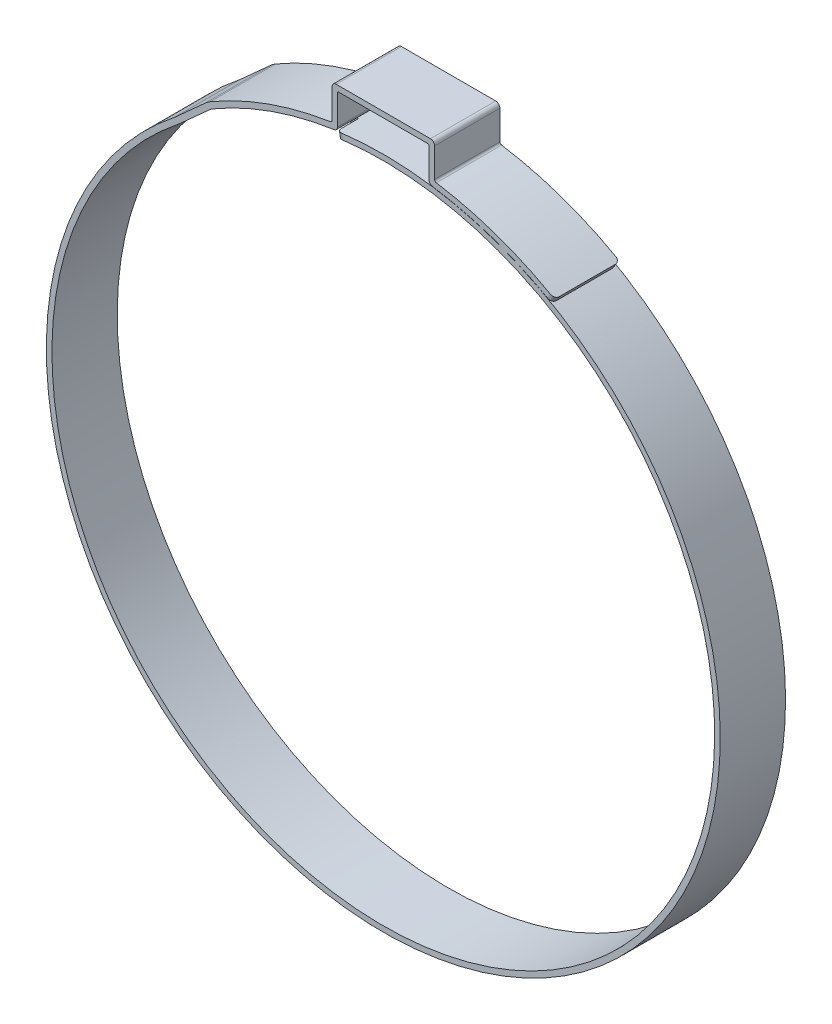
from build123d import *

# Parameters (mm, degrees)
BOSS_EXTRUDE1_DEPTH = 3.571875
SHELL1_T            = -0.6096
EXTRUDE_THIN3_DEPTH = 3.571875
EXTRUDE_THIN4_DEPTH = 3.571875
EXTRUDE_THIN6_DEPTH = 1.190625
FILLET4_R           = 0.4572
FILLET5_R           = 0.2286
FILLET6_R           = 0.1143
FILLET7_R           = 0.508


with BuildPart() as part:
    # Sketch1 → Boss-Extrude1 (new, symmetric)
    with BuildSketch(Plane.XY):
        Polygon((-5.6096, 36.544537554), (-5.6096, 40.904137554), (5.6096, 40.904137554), (5.6096, 36.544537554), (5, 36.544537554), (-5, 36.544537554), align=None)
    extrude(amount=BOSS_EXTRUDE1_DEPTH, both=True)

    # Shell1
    shell1_openings = [part.faces().sort_by_distance(p)[0] for p in [
        (0, 38.724337554, 3.571875),
        (0, 36.544537554, 0),
        (0, 38.724337554, -3.571875),
    ]]
    offset(amount=SHELL1_T, openings=shell1_openings, kind=Kind.INTERSECTION)

    # Sketch5 → Extrude-Thin3 (add, symmetric)
    with BuildSketch(Plane.XY):
        with BuildLine():
            ThreePointArc((5, 36.544537554), (11.940161205, 34.898936594), (18.433839197, 31.94834577))
            Line((18.433839197, 31.94834577), (18.73849606, 32.476357471))
            ThreePointArc((18.73849606, 32.476357471), (12.137496769, 35.475712838), (5.082635218, 37.148510716))
            Line((5.082635218, 37.148510716), (5, 36.544537554))
        make_face()
    extrude(amount=EXTRUDE_THIN3_DEPTH, both=True)

    # Sketch6 → Extrude-Thin4 (add, symmetric)
    with BuildSketch(Plane.XY):
        with BuildLine():
            ThreePointArc((-5, 36.544537554), (-12.040640524, 34.864397324), (-18.617591459, 31.841616059))
            ThreePointArc((-18.617591459, 31.841616059), (-18.834321384, 31.699568311), (-19.035434065, 31.536157441))
            Line((-19.035434065, 31.536157441), (-22.368712445, 28.532557322))
            ThreePointArc((-22.368712445, 28.532557322), (-22.429942096, 28.479134983), (-22.492850889, 28.427700556))
            ThreePointArc((-22.492850889, 28.427700556), (-25.983133611, 25.277248025), (-29.036283269, 21.701538054))
            ThreePointArc((-29.036283269, 21.701538054), (18.440205881, -31.209314428), (-5, 35.903516541))
            Line((-5, 35.903516541), (-5.084082759, 36.507289884))
            ThreePointArc((-5.084082759, 36.507289884), (18.750306557, -31.734147479), (-29.524573428, 22.066483092))
            ThreePointArc((-29.524573428, 22.066483092), (-26.420080322, 25.702324174), (-22.871103079, 28.905756453))
            ThreePointArc((-22.871103079, 28.905756453), (-22.823307272, 28.944834455), (-22.776787215, 28.985422801))
            Line((-22.776787215, 28.985422801), (-19.443508835, 31.989022921))
            ThreePointArc((-19.443508835, 31.989022921), (-19.194081556, 32.191691038), (-18.925285204, 32.367863833))
            ThreePointArc((-18.925285204, 32.367863833), (-12.239636714, 35.440602736), (-5.082635218, 37.148510716))
            Line((-5.082635218, 37.148510716), (-5, 36.544537554))
        make_face()
    extrude(amount=EXTRUDE_THIN4_DEPTH, both=True)

    # Sketch9 → Extrude-Thin6 (add, symmetric)
    with BuildSketch(Plane.XY):
        with BuildLine():
            ThreePointArc((-5, 35.903516541), (-11.874411535, 34.249975923), (-18.297077143, 31.293441294))
            Line((-18.297077143, 31.293441294), (-18.604770887, 31.819689068))
            ThreePointArc((-18.604770887, 31.819689068), (-12.07409819, 34.825942414), (-5.084082759, 36.507289884))
            Line((-5.084082759, 36.507289884), (-5, 35.903516541))
        make_face()
    extrude(amount=EXTRUDE_THIN6_DEPTH, both=True)

    # Fillet4
    fillet4_edges = [part.edges().sort_by_distance(p)[0] for p in [
        (-5.6096, 40.904137554, 0),
        (5.6096, 40.904137554, 0),
        (5, 36.544537554, 0),
        (-5, 36.544537554, 0),
    ]]
    fillet(fillet4_edges, radius=FILLET4_R)

    # Fillet5
    fillet5_edges = [part.edges().sort_by_distance(p)[0] for p in [
        (5.6096, 37.072596578, 0),
        (-5.6096, 37.072596578, 0),
    ]]
    fillet(fillet5_edges, radius=FILLET5_R)

    # Fillet6
    fillet6_edges = [part.edges().sort_by_distance(p)[0] for p in [
        (5, 40.294537554, 0),
        (-5, 40.294537554, 0),
    ]]
    fillet(fillet6_edges, radius=FILLET6_R)

    # Fillet7
    fillet7_edges = [part.edges().sort_by_distance(p)[0] for p in [
        (18.586167628, 32.212351621, -3.571875),
        (18.586167628, 32.212351621, 3.571875),
        (-5.042041379, 36.205403212, -3.571875),
        (-5.042041379, 36.205403212, 3.571875),
        (-18.450924015, 31.556565181, 1.190625),
        (-18.450924015, 31.556565181, -1.190625),
    ]]
    fillet(fillet7_edges, radius=FILLET7_R)


solid = part.part
